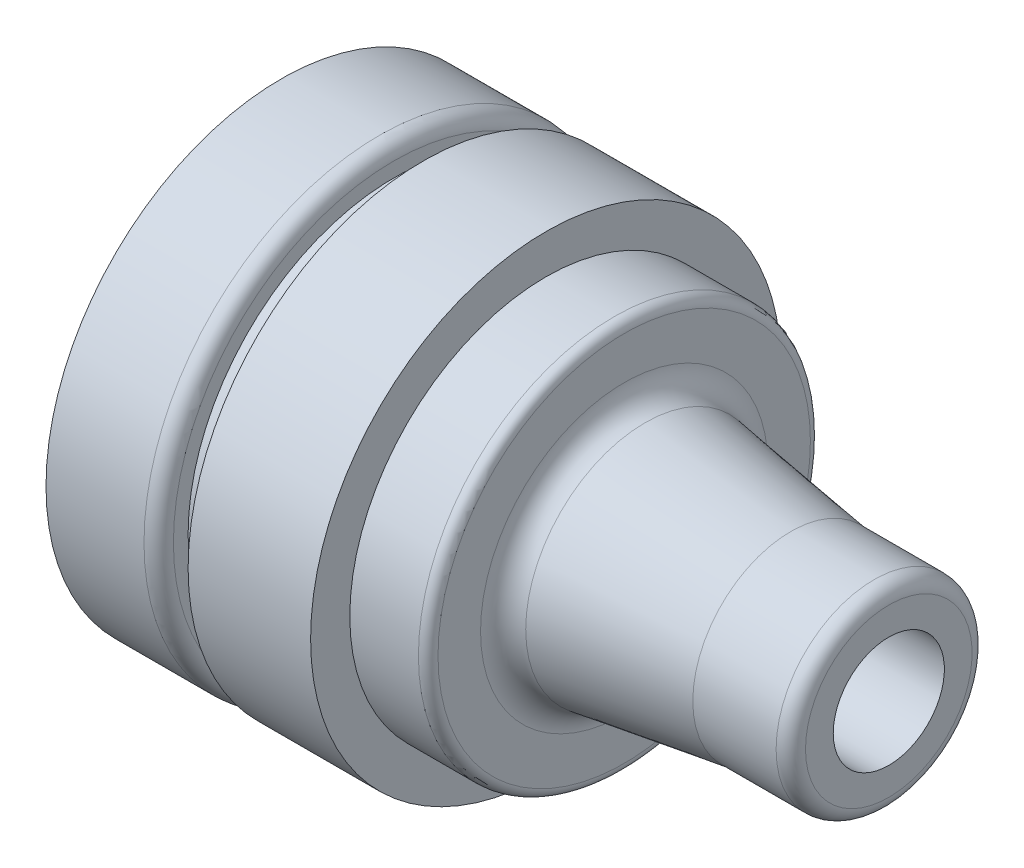
from build123d import *

# Parameters (mm, degrees)
SKETCH1_W = 6
SKETCH1_H = 22.915


with BuildPart() as part:
    # Sketch1 → Revolve1 (revolve)
    with BuildSketch(Plane.XY, mode=Mode.PRIVATE) as revolve1_sk:
        with BuildLine():
            Line((-8.959217604, 38), (0, 19.085))
            Line((0, 19.085), (14.040782396, 19.085))
            Line((14.040782396, 19.085), (14.040782396, 42))
            Line((14.040782396, 42), (14.040782396, 45))
            ThreePointArc((14.040782396, 45), (13.16210274, 47.121320344), (11.040782396, 48))
            Line((11.040782396, 48), (-8.959217604, 48))
            Line((-8.959217604, 48), (-8.959217604, 38))
        make_face()
        with Locations((17.040782396, 30.5425)):
            Rectangle(SKETCH1_W, SKETCH1_H)
        Polygon((20.040782396, 42), (20.040782396, 19.085), (28.557506112, 19.085), (45.040782396, 19.085), (45.040782396, 40), (45.040782396, 48), (20.040782396, 48), align=None)
        with BuildLine():
            Line((57.520391198, 19.085), (57.520391198, 11.33900978))
            Line((57.520391198, 11.33900978), (95.040782396, 11.33900978))
            Line((95.040782396, 11.33900978), (95.040782396, 20))
            Line((95.040782396, 20), (65.313312444, 24.371686758))
            ThreePointArc((65.313312444, 24.371686758), (62.256779901, 26.050252773), (61.040782396, 29.318482435))
            Line((61.040782396, 29.318482435), (61.040782396, 38))
            ThreePointArc((61.040782396, 38), (60.454995958, 39.414213562), (59.040782396, 40))
            Line((59.040782396, 40), (54.186650367, 40))
            Line((54.186650367, 40), (45.040782396, 40))
            Line((45.040782396, 40), (45.040782396, 19.085))
            Line((45.040782396, 19.085), (57.520391198, 19.085))
        make_face()
        with BuildLine():
            Line((95.040782396, 11.33900978), (115.040782396, 11.33900978))
            Line((115.040782396, 11.33900978), (115.040782396, 17))
            ThreePointArc((115.040782396, 17), (114.16210274, 19.121320344), (112.040782396, 20))
            Line((112.040782396, 20), (95.040782396, 20))
            Line((95.040782396, 20), (95.040782396, 11.33900978))
        make_face()
    revolve(revolve1_sk.sketch.rotate(Axis((0, 0, 0), (1, 0, 0)), 90), axis=Axis((0, 0, 0), (1, 0, 0)))


solid = part.part
